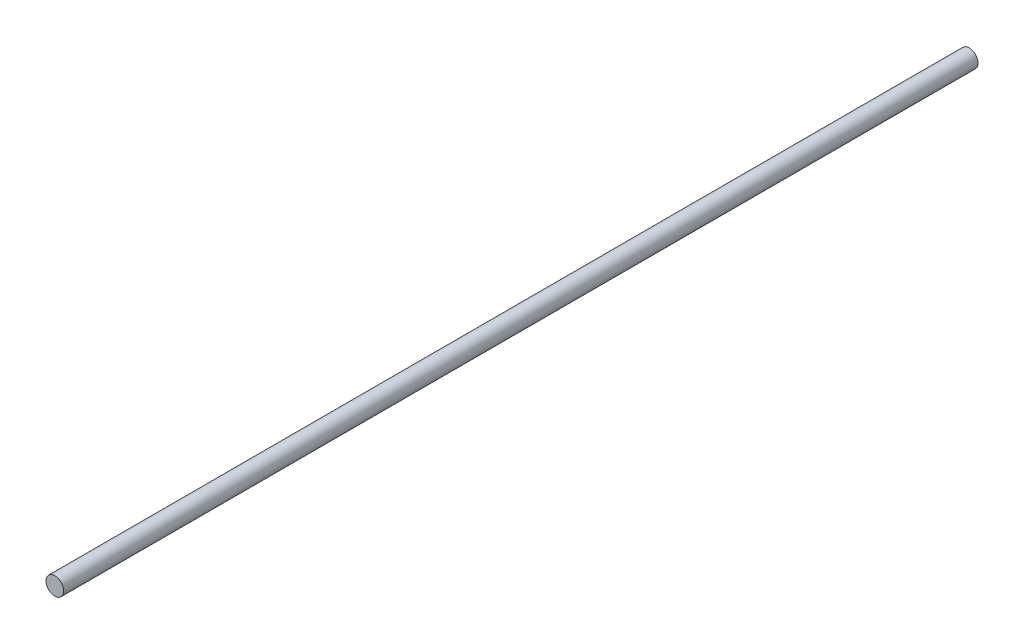
from build123d import *

# Parameters (mm, degrees)
SKETCH1_R           = 1.5
BOSS_EXTRUDE1_DEPTH = 77.675


with BuildPart() as part:
    # Sketch1 → Boss-Extrude1 (new, symmetric)
    with BuildSketch(Plane.XY):
        Circle(SKETCH1_R)
    extrude(amount=BOSS_EXTRUDE1_DEPTH, both=True)


solid = part.part
